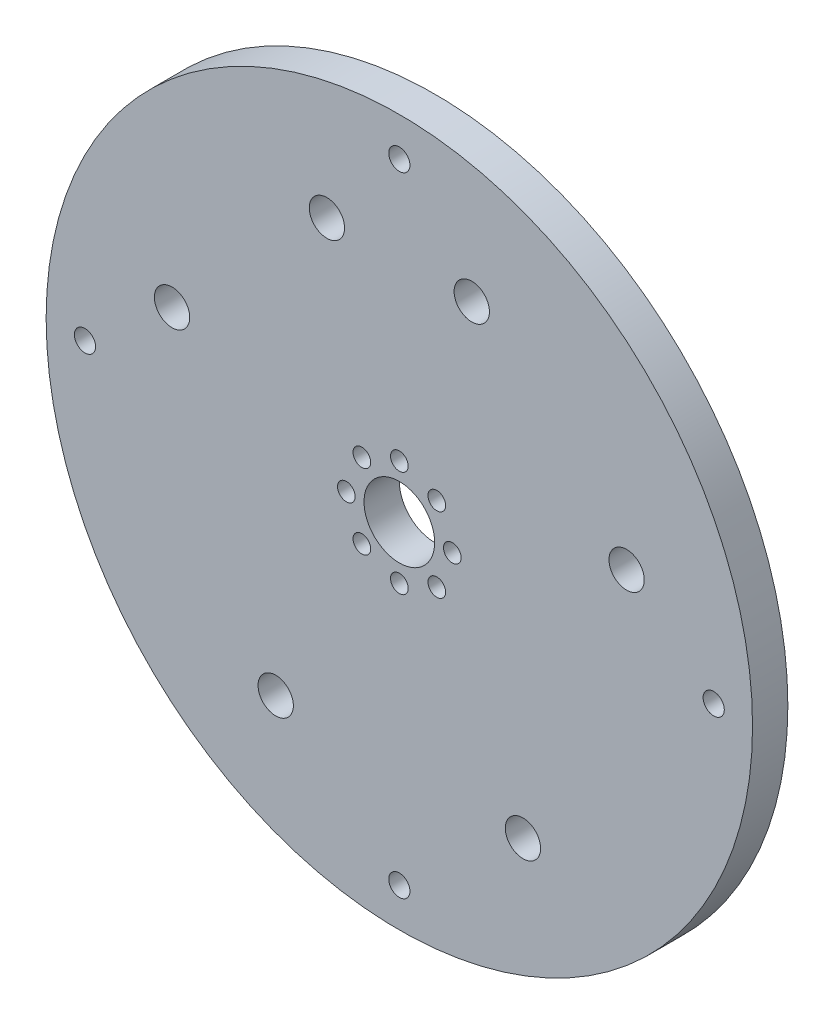
from build123d import *

# Parameters (mm, degrees)
SKETCH_1_R      = 50
SKETCH_1_R_2    = 1.5
SKETCH_1_R_3    = 1.25
SKETCH_1_R_4    = 5
SKETCH_1_R_5    = 2.5
EXTRUDE_1_DEPTH = 5


with BuildPart() as part:
    # 草图1 → 凸台-拉伸1 (new body)
    with BuildSketch(Plane.XY):
        Circle(SKETCH_1_R)
        with Locations((0, 44.5)):
            Circle(SKETCH_1_R_2, mode=Mode.SUBTRACT)
        with Locations((44.5, 0)):
            Circle(SKETCH_1_R_2, mode=Mode.SUBTRACT)
        with Locations((0, -44.5)):
            Circle(SKETCH_1_R_2, mode=Mode.SUBTRACT)
        with Locations((-44.5, 0)):
            Circle(SKETCH_1_R_2, mode=Mode.SUBTRACT)
        with Locations((0, 7.5)):
            Circle(SKETCH_1_R_3, mode=Mode.SUBTRACT)
        with Locations((5.303300859, 5.303300859)):
            Circle(SKETCH_1_R_3, mode=Mode.SUBTRACT)
        with Locations((7.5, 0)):
            Circle(SKETCH_1_R_3, mode=Mode.SUBTRACT)
        with Locations((5.303300859, -5.303300859)):
            Circle(SKETCH_1_R_3, mode=Mode.SUBTRACT)
        with Locations((0, -7.5)):
            Circle(SKETCH_1_R_3, mode=Mode.SUBTRACT)
        with Locations((-5.303300859, -5.303300859)):
            Circle(SKETCH_1_R_3, mode=Mode.SUBTRACT)
        with Locations((-7.5, 0)):
            Circle(SKETCH_1_R_3, mode=Mode.SUBTRACT)
        with Locations((-5.303300859, 5.303300859)):
            Circle(SKETCH_1_R_3, mode=Mode.SUBTRACT)
        Circle(SKETCH_1_R_4, mode=Mode.SUBTRACT)
        with Locations((-10.253048327, 32.173358544)):
            Circle(SKETCH_1_R_5, mode=Mode.SUBTRACT)
        with Locations((-32.173358544, 10.253048327)):
            Circle(SKETCH_1_R_5, mode=Mode.SUBTRACT)
        with Locations(Location((10.253048327, 32.173358544, 0), (0, 0, 180))):
            Circle(SKETCH_1_R_5, mode=Mode.SUBTRACT)
        with Locations(Location((32.173358544, 10.253048327, 0), (0, 0, 180))):
            Circle(SKETCH_1_R_5, mode=Mode.SUBTRACT)
        with Locations((-17.5, -30)):
            Circle(SKETCH_1_R_5, mode=Mode.SUBTRACT)
        with Locations((17.5, -30)):
            Circle(SKETCH_1_R_5, mode=Mode.SUBTRACT)
    extrude(amount=EXTRUDE_1_DEPTH)


solid = part.part
